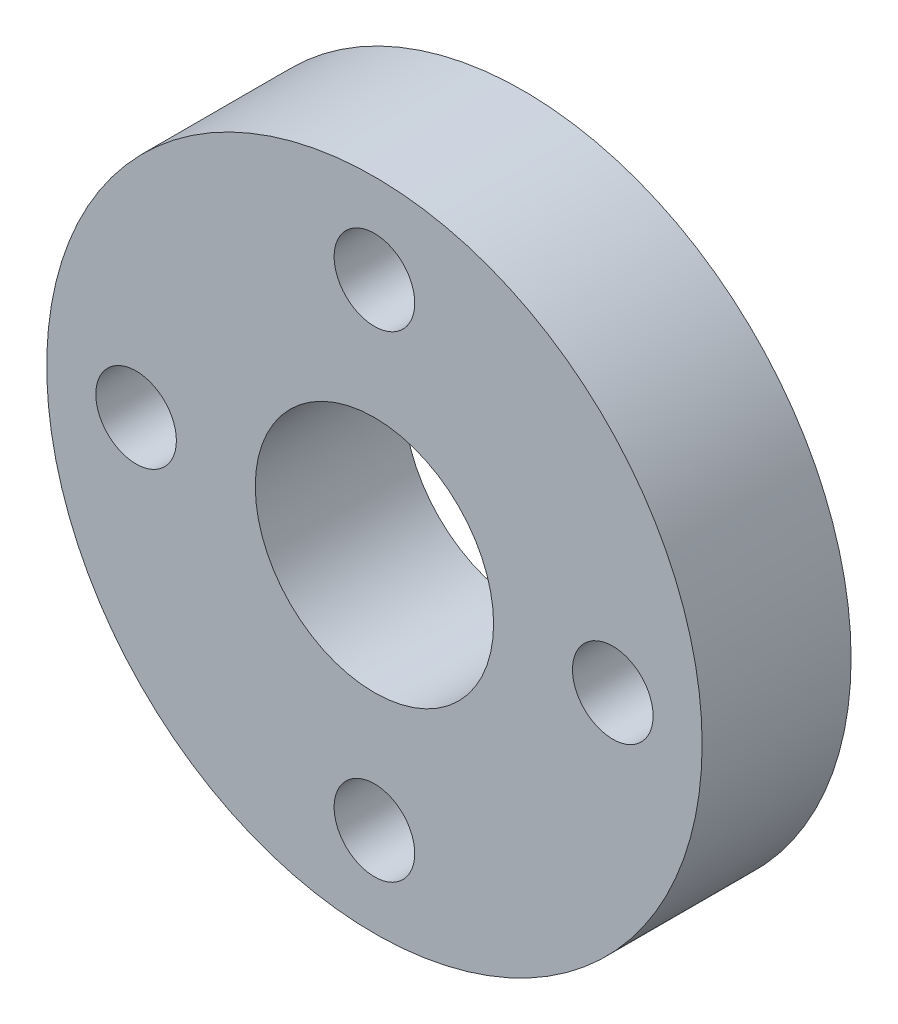
from build123d import *

# Parameters (mm, degrees)
SKETCH1_R             = 11
SKETCH1_R_2           = 4
BOSS_EXTRUDE1_DEPTH   = 2.5
F_6_32_TAPPED_HOLE1_D = 2.7051


with BuildPart() as part:
    # Sketch1 → Boss-Extrude1 (new, symmetric)
    with BuildSketch(Plane.XY):
        Circle(SKETCH1_R)
        Circle(SKETCH1_R_2, mode=Mode.SUBTRACT)
    extrude(amount=BOSS_EXTRUDE1_DEPTH, both=True)

    # #6-32 Tapped Hole1 (through all)
    with Locations(Plane.XY.offset(2.5)):
        with Locations((-8, 0), (0, -8), (8, 0), (0, 8)):
            Hole(F_6_32_TAPPED_HOLE1_D / 2)


solid = part.part
